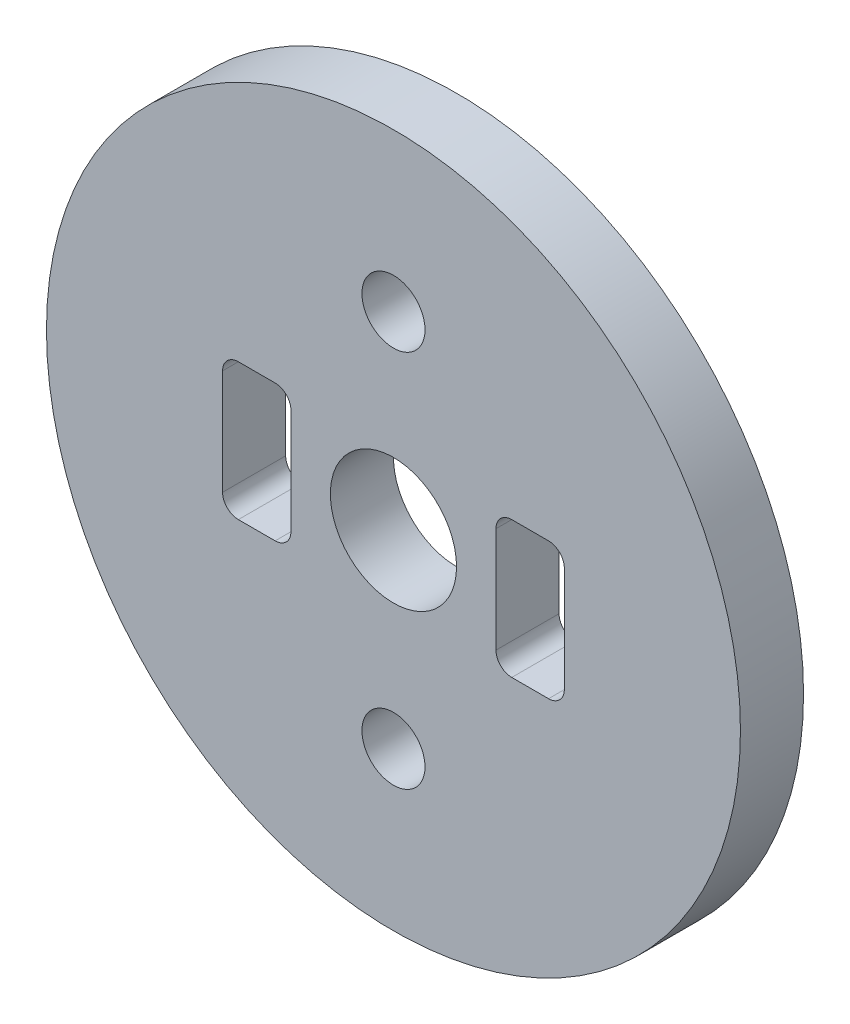
from build123d import *

# Parameters (mm, degrees)
MODEL_R                 = 16.5
MODEL_R_2               = 3
MODEL_R_3               = 1.5
SALIENTE_EXTRUIR1_DEPTH = 3


with BuildPart() as part:
    # Model → Saliente-Extruir1 (new body)
    with BuildSketch(Plane.XY):
        with Locations((215.747807914, 241.952019993)):
            Circle(MODEL_R)
        with Locations((215.747807914, 241.952019993)):
            Circle(MODEL_R_2, mode=Mode.SUBTRACT)
        with Locations((215.747807914, 232.952019993)):
            Circle(MODEL_R_3, mode=Mode.SUBTRACT)
        with Locations((215.747807914, 250.952019993)):
            Circle(MODEL_R_3, mode=Mode.SUBTRACT)
        with BuildLine():
            Line((223.122807913, 245.202019993), (221.372807913, 245.202019993))
            ThreePointArc((221.372807913, 245.202019993), (220.842477828, 244.982350079), (220.622807913, 244.452019993))
            Line((220.622807913, 244.452019993), (220.622807913, 239.452019993))
            ThreePointArc((220.622807913, 239.452019993), (220.842477828, 238.921689907), (221.372807913, 238.702019993))
            Line((221.372807913, 238.702019993), (223.122807913, 238.702019993))
            ThreePointArc((223.122807913, 238.702019993), (223.653137999, 238.921689907), (223.872807913, 239.452019993))
            Line((223.872807913, 239.452019993), (223.872807913, 244.452019993))
            ThreePointArc((223.872807913, 244.452019993), (223.653137999, 244.982350079), (223.122807913, 245.202019993))
        make_face(mode=Mode.SUBTRACT)
        with BuildLine():
            Line((208.372807913, 245.202019993), (210.122807913, 245.202019993))
            ThreePointArc((210.122807913, 245.202019993), (210.653137999, 244.982350079), (210.872807913, 244.452019993))
            Line((210.872807913, 244.452019993), (210.872807913, 239.452019993))
            ThreePointArc((210.872807913, 239.452019993), (210.653137999, 238.921689907), (210.122807913, 238.702019993))
            Line((210.122807913, 238.702019993), (208.372807913, 238.702019993))
            ThreePointArc((208.372807913, 238.702019993), (207.842477828, 238.921689907), (207.622807913, 239.452019993))
            Line((207.622807913, 239.452019993), (207.622807913, 244.452019993))
            ThreePointArc((207.622807913, 244.452019993), (207.842477828, 244.982350079), (208.372807913, 245.202019993))
        make_face(mode=Mode.SUBTRACT)
    extrude(amount=SALIENTE_EXTRUIR1_DEPTH)


solid = part.part
